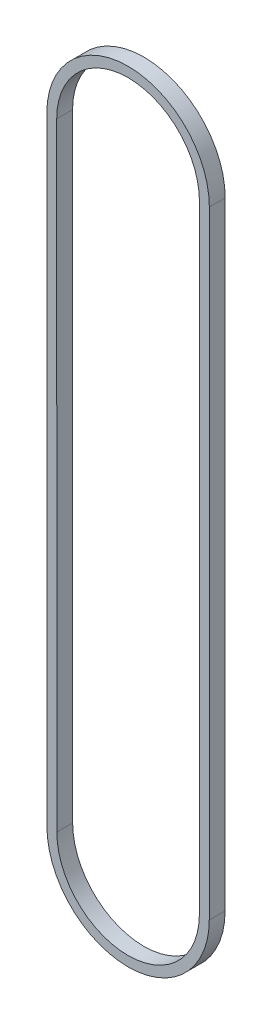
from build123d import *

# Parameters (mm, degrees)
BOSS_EXTRUDE1_DEPTH = 4.064


with BuildPart() as part:
    # Sketch1 → Boss-Extrude1 (new body)
    with BuildSketch(Plane.XY):
        with BuildLine():
            Line((-26.310634103, 125.897752486), (-26.285234103, -32.585543443))
            ThreePointArc((-26.285234103, -32.585543443), (-5.457234371, -53.410205355), (15.370765362, -32.585543443))
            Line((15.370765362, -32.585543443), (15.396165361, 125.897752486))
            ThreePointArc((15.396165361, 125.897752486), (-5.457234371, 146.754494645), (-26.310634103, 125.897752486))
        make_face()
        with BuildLine():
            Line((-23.770634136, 125.89815957), (-23.745234136, -32.58513636))
            ThreePointArc((-23.745234136, -32.58513636), (-5.457234371, -50.870205355), (12.830765394, -32.58513636))
            Line((12.830765394, -32.58513636), (12.856165394, 125.89815957))
            ThreePointArc((12.856165394, 125.89815957), (-5.457234371, 144.214494645), (-23.770634136, 125.89815957))
        make_face(mode=Mode.SUBTRACT)
    extrude(amount=BOSS_EXTRUDE1_DEPTH)


solid = part.part
